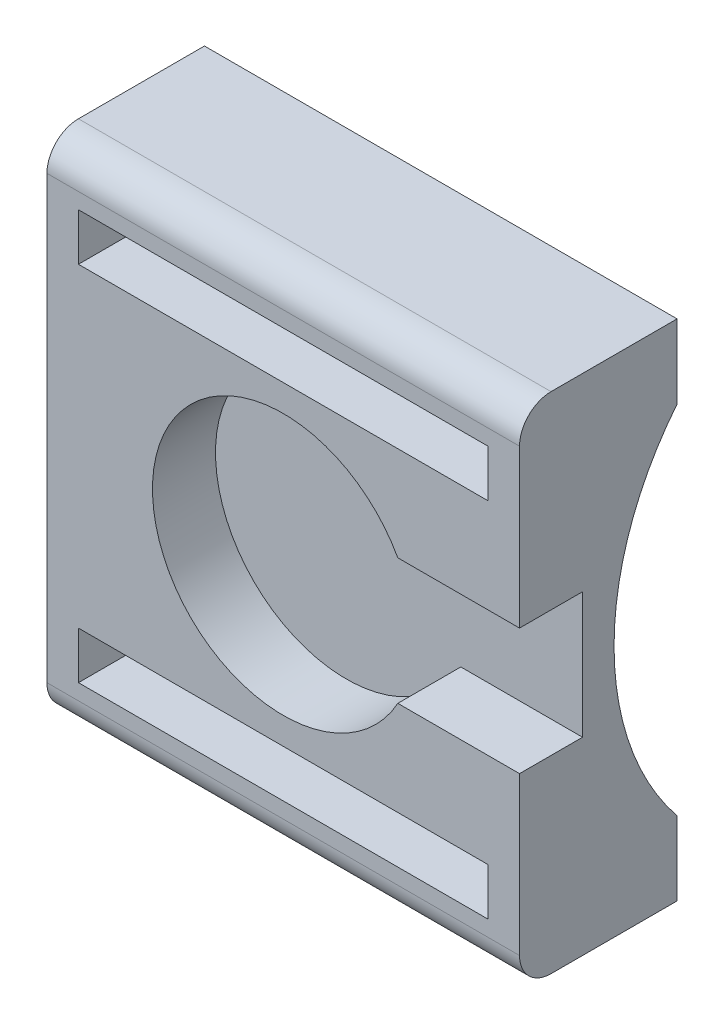
from build123d import *

# Parameters (mm, degrees)
SKETCH1_W           = 15
SKETCH1_H           = 16
BOSS_EXTRUDE1_DEPTH = 5
SKETCH2_R           = 4.15
CUT_EXTRUDE1_DEPTH  = 2
SKETCH4_W           = 4
SKETCH4_H           = 4
CUT_EXTRUDE2_DEPTH  = 4
SKETCH8_W           = 13
SKETCH8_H           = 1.5
CUT_EXTRUDE4_DEPTH  = 10
SKETCH9_R           = 9
CUT_EXTRUDE6_DEPTH  = 50
FILLET2_R           = 1
FILLET3_R           = 1


with BuildPart() as part:
    # Sketch1 → Boss-Extrude1 (new body)
    with BuildSketch(Plane.XY):
        Rectangle(SKETCH1_W, SKETCH1_H)
    extrude(amount=BOSS_EXTRUDE1_DEPTH)

    # Sketch2 → Cut-Extrude1 (cut)
    with BuildSketch(Plane.XY.offset(5)):
        Circle(SKETCH2_R)
    extrude(amount=-CUT_EXTRUDE1_DEPTH, mode=Mode.SUBTRACT)

    # Sketch4 → Cut-Extrude2 (cut)
    with BuildSketch(Plane(origin=(7.5, 0, 0), x_dir=(0, 0, -1), z_dir=(1, 0, 0))):
        with Locations((-5, 0)):
            Rectangle(SKETCH4_W, SKETCH4_H)
    extrude(amount=-CUT_EXTRUDE2_DEPTH, mode=Mode.SUBTRACT)

    # Sketch8 → Cut-Extrude4 (cut)
    with BuildSketch(Plane.XY.offset(5)):
        with Locations((0, 5.75)):
            Rectangle(SKETCH8_W, SKETCH8_H)
        with Locations((0, -5.75)):
            Rectangle(SKETCH8_W, SKETCH8_H)
    extrude(amount=-CUT_EXTRUDE4_DEPTH, mode=Mode.SUBTRACT)

    # Sketch9 → Cut-Extrude6 (cut)
    with BuildSketch(Plane.ZY.offset(7.5)):
        with Locations((-7, 0)):
            Circle(SKETCH9_R)
    extrude(amount=-CUT_EXTRUDE6_DEPTH, mode=Mode.SUBTRACT)

    # Fillet2
    fillet2_edges = [part.edges().sort_by_distance(p)[0] for p in [
        (0, 8, 5),
    ]]
    fillet(fillet2_edges, radius=FILLET2_R)

    # Fillet3
    fillet3_edges = [part.edges().sort_by_distance(p)[0] for p in [
        (0, -8, 5),
    ]]
    fillet(fillet3_edges, radius=FILLET3_R)


solid = part.part
